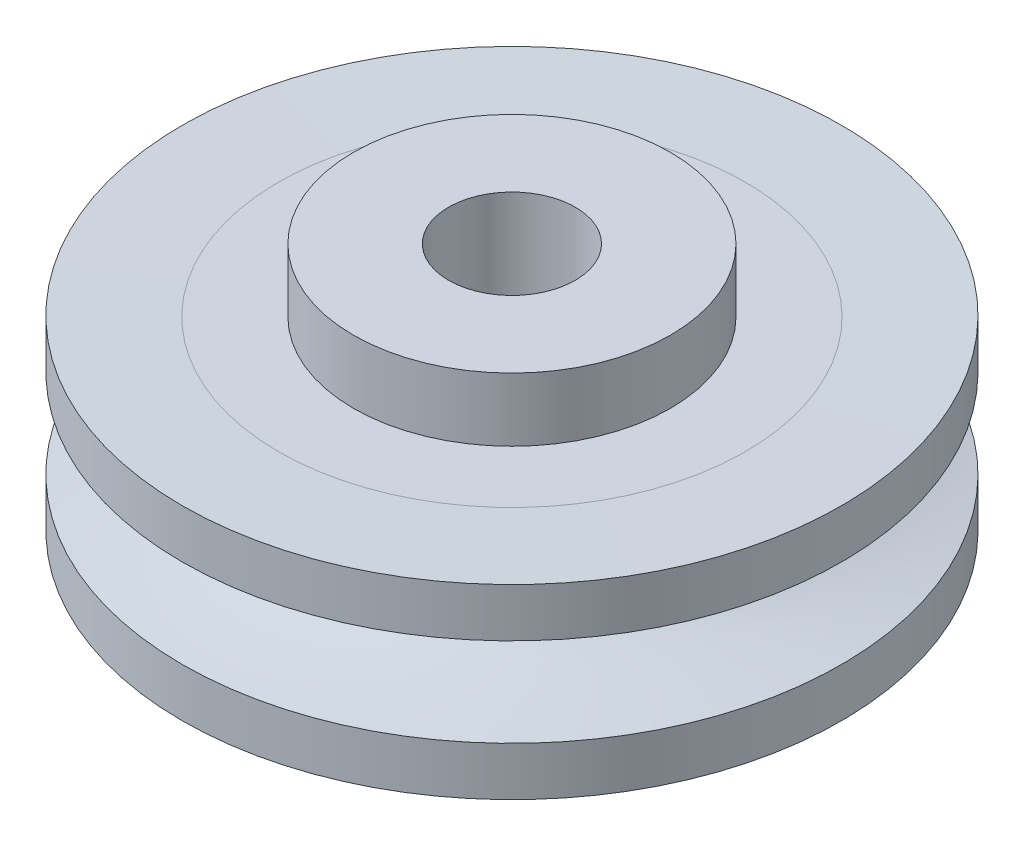
from build123d import *


with BuildPart() as part:
    # 草图1 → 旋转9 (revolve)
    with BuildSketch(Plane.XY, mode=Mode.PRIVATE) as revolve_9_sk:
        with BuildLine():
            Line((2.5, -1.45), (3.683096715, -1.45))
            Line((3.683096715, -1.45), (5.2, -1.469540433))
            Line((5.2, -1.469540433), (5.2, -0.7))
            add(Edge.make_bspline(
                [(5.2, 0.7), (2.075182916, 0), (5.2, -0.7)],
                knots=[0, 0, 0, 1, 1, 1], degree=2, weights=[1, 1.049306187, 1]))
            Line((5.2, 0.7), (5.2, 1.469540433))
            Line((5.2, 1.469540433), (3.683096715, 1.45))
            Line((3.683096715, 1.45), (2.5, 1.45))
            Line((2.5, 1.45), (2.5, 2.45))
            Line((2.5, 2.45), (1, 2.45))
            Line((1, 2.45), (1, -2.45))
            Line((1, -2.45), (2.5, -2.45))
            Line((2.5, -2.45), (2.5, -1.45))
        make_face()
    revolve(revolve_9_sk.sketch.rotate(Axis((0, 2.07863921, 0), (0, -1, 0)), 90), axis=Axis((0, 2.07863921, 0), (0, -1, 0)))


solid = part.part
